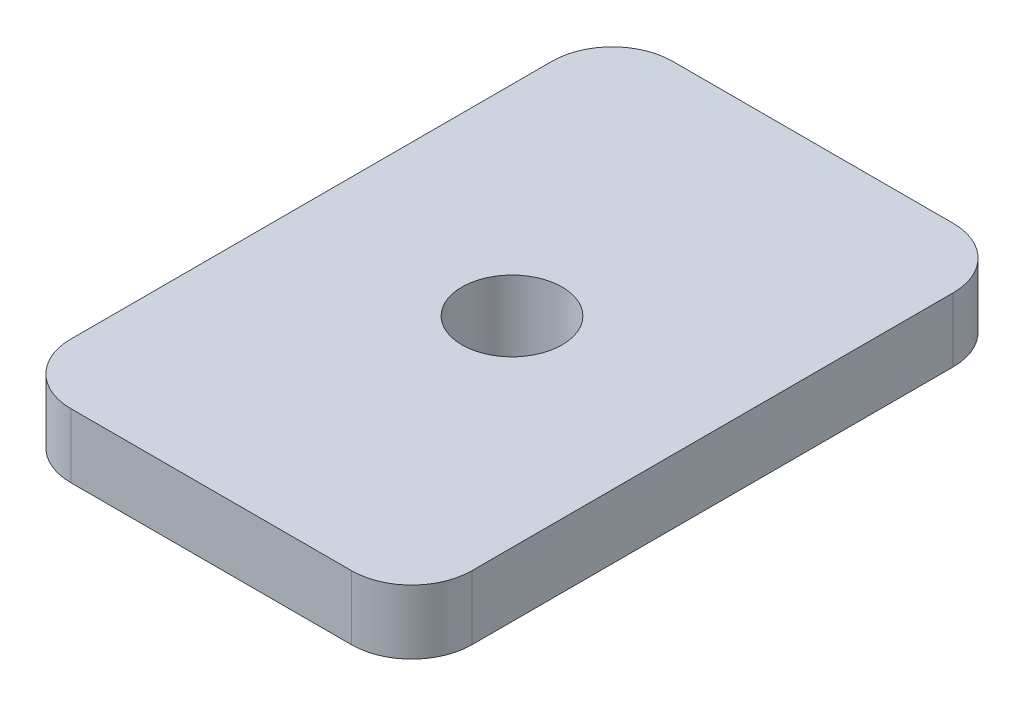
from build123d import *

# Parameters (mm, degrees)
SKETCH1_W             = 10
SKETCH1_H             = 15
BOSS_EXTRUDE1_DEPTH   = 1.6
FILLET1_R             = 1.5
SKETCH2_R             = 3.45
BOSS_EXTRUDE2_DEPTH   = 1.4
M3X0_5_TAPPED_HOLE1_D = 2.5


with BuildPart() as part:
    # Sketch1 → Boss-Extrude1 (new body)
    with BuildSketch(Plane(origin=(0, 0, 0), x_dir=(1, 0, 0), z_dir=(0, 1, 0))):
        with Locations((5, 7.5)):
            Rectangle(SKETCH1_W, SKETCH1_H)
    extrude(amount=BOSS_EXTRUDE1_DEPTH)

    # Fillet1
    fillet1_edges = [part.edges().sort_by_distance(p)[0] for p in [
        (0, 0.8, -15),
        (10, 0.8, -15),
        (10, 0.8, 0),
        (0, 0.8, 0),
    ]]
    fillet(fillet1_edges, radius=FILLET1_R)

    # Sketch2 → Boss-Extrude2 (add)
    with BuildSketch(Plane.XZ):
        with Locations(Location((5, -7.5, 0), (0, 0, 270))):
            Circle(SKETCH2_R)
    extrude(amount=BOSS_EXTRUDE2_DEPTH)

    # M3x0.5 Tapped Hole1 (through all)
    with Locations(Plane(origin=(0, 1.6, 0), x_dir=(1, 0, 0), z_dir=(0, 1, 0))):
        with Locations((5, 7.5)):
            Hole(M3X0_5_TAPPED_HOLE1_D / 2)


solid = part.part
